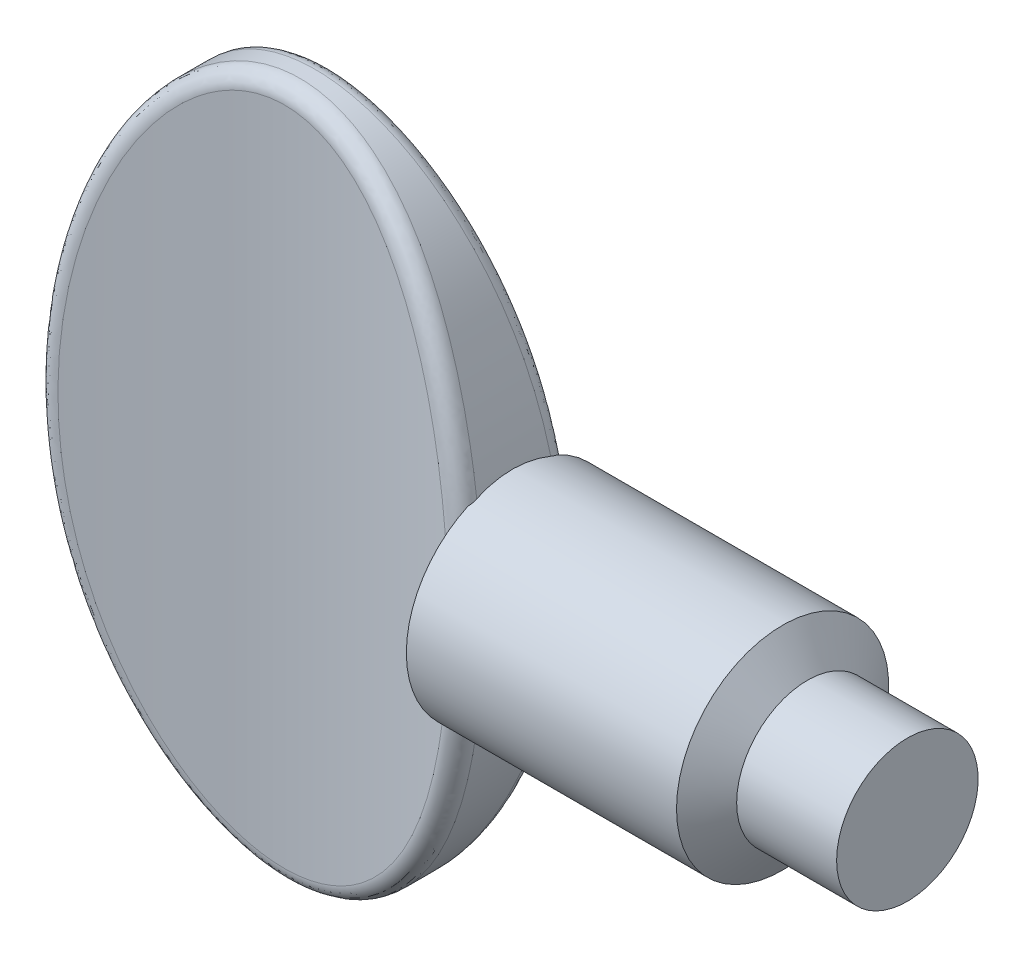
from build123d import *

# Parameters (mm, degrees)
SKETCH1_RX              = 5.715
SKETCH1_RY              = 3.556
EXTRUDE1_DEPTH          = 1.016
CUT_EXTRUDE1_DEPTH      = 7.8072473878947575
CUT_EXTRUDE1_DEPTH_BACK = 7.8072473878947575
SKETCH2_OUTSIDE_W       = 11.834000000000001
SKETCH2_OUTSIDE_H       = 6.754
FILLET3_R               = 0.254


with BuildPart() as part:
    # Sketch1 → Extrude1 (new, symmetric)
    with BuildSketch(Plane.XY):
        with Locations(Location((0, 0), (0, 0, -90))):
            Ellipse(SKETCH1_RX, SKETCH1_RY)
    extrude(amount=EXTRUDE1_DEPTH, both=True)

    # Sketch2 outside → Cut-Extrude1 (cut, two sides: drawn at the far end of the back side and taken through both)
    with BuildSketch(Plane(origin=(0, 0, 0), x_dir=(1, 0, 0), z_dir=(0, 1, 0)).offset(-CUT_EXTRUDE1_DEPTH_BACK)):
        Rectangle(SKETCH2_OUTSIDE_W, SKETCH2_OUTSIDE_H)
        with BuildLine():
            Line((-3.556, 1.016), (-3.556, -1.016))
            ThreePointArc((-3.556, -1.016), (6.3e-16, -0.3810000000000002), (3.556, -1.016))
            Line((3.556, -1.016), (3.556, 1.016))
            ThreePointArc((3.556, 1.016), (6.3e-16, 0.3810000000000002), (-3.556, 1.016))
        make_face(mode=Mode.SUBTRACT)
    extrude(amount=CUT_EXTRUDE1_DEPTH + CUT_EXTRUDE1_DEPTH_BACK, mode=Mode.SUBTRACT)

    # Fillet3
    fillet3_edges = [part.edges().sort_by_distance(p)[0] for p in [
        (-2.772297743363364, -3.579097133488567, 0.7620899166368158),
        (6.761380256e-08, 5.714999999994567, -0.38099999999467776),
    ]]
    fillet(fillet3_edges, radius=FILLET3_R)

    # Sketch3 → Revolve1 (revolve)
    with BuildSketch(Plane(origin=(0, 0, 0), x_dir=(1, 0, 0), z_dir=(0, 1, 0))):
        with BuildLine():
            Line((9.906, 0), (9.906, 1.1684))
            Line((9.906, 1.1684), (8.255, 1.1683999999999999))
            Line((8.255, 1.1683999999999999), (7.845938756177886, 1.7526))
            Line((7.845938756177886, 1.7526), (4.741333333333333, 1.7526))
            Line((4.741333333333333, 1.7526), (3.3846611661960426, 1.7526000000000004))
            ThreePointArc((3.3846611661960426, 1.7526000000000004), (3.1592934071520324, 1.093146291526699), (2.577464628985661, 0.7095513315322604))
            Line((2.577464628985661, 0.7095513315322604), (2.577464628985661, 1e-17))
            Line((2.577464628985661, 1e-17), (9.906, 0))
        make_face()
    revolve(axis=Axis((0, 0, 0), (1, 0, 0)))


solid = part.part
